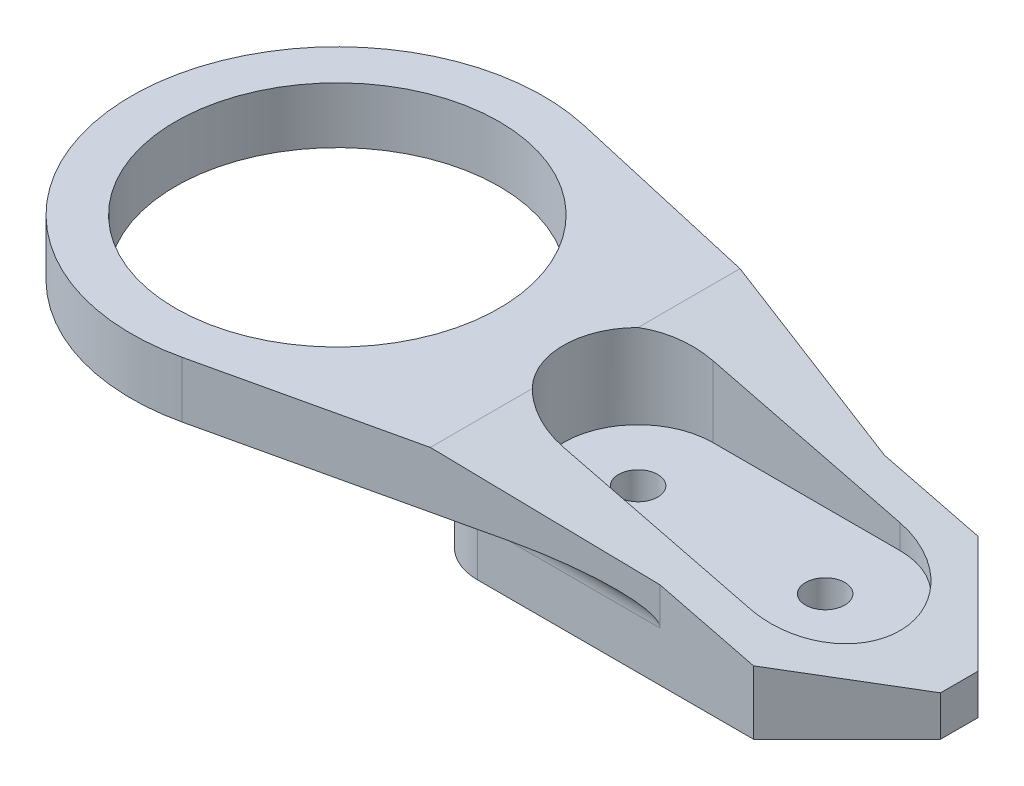
from build123d import *

# Parameters (mm, degrees)
SKETCH1_W           = 25
SKETCH1_H           = 7.15
BOSS_EXTRUDE1_DEPTH = 12
BOSS_EXTRUDE2_DEPTH = 3
CUT_EXTRUDE1_DEPTH  = 21
SKETCH4_R           = 8.65
CUT_EXTRUDE2_DEPTH  = 10
CHAMFER1_SIZE       = 5
CHAMFER1_SIZE2      = 20
CHAMFER2_SIZE       = 5
SKETCH6_R           = 1.05
CUT_EXTRUDE3_DEPTH  = 10
CUT_EXTRUDE4_DEPTH  = 4.5
FILLET1_R           = 3
FILLET2_R           = 1.5


with BuildPart() as part:
    # Sketch1 → Boss-Extrude1 (new body)
    with BuildSketch(Plane.XY):
        with Locations((12.5, 3.575)):
            Rectangle(SKETCH1_W, SKETCH1_H)
    extrude(amount=BOSS_EXTRUDE1_DEPTH)

    # Sketch2 → Boss-Extrude2 (add)
    with BuildSketch(Plane(origin=(0, 7.15, 0), x_dir=(1, 0, 0), z_dir=(0, 1, 0))):
        with BuildLine():
            Line((15, -12), (15, -6))
            Line((15, -6), (15, 0))
            Line((15, 0), (-5.804949202, 4.737516245))
            ThreePointArc((-5.804949202, 4.737516245), (-19.262380692, -6), (-5.804949202, -16.737516245))
            Line((-5.804949202, -16.737516245), (15, -12))
        make_face()
    extrude(amount=-BOSS_EXTRUDE2_DEPTH)

    # Sketch3 → Cut-Extrude1 (cut)
    with BuildSketch(Plane.XZ.offset(-4.15)):
        Polygon((2.25, 6), (2.25, 12), (0, 12), (0, 0), (2.25, 0), align=None)
    extrude(amount=CUT_EXTRUDE1_DEPTH, mode=Mode.SUBTRACT)

    # Sketch4 → Cut-Extrude2 (cut)
    with BuildSketch(Plane.XZ.offset(-4.15)):
        with Locations(Location((-8.25, 6, 0), (0, 0, 270))):
            Circle(SKETCH4_R)
    extrude(amount=-CUT_EXTRUDE2_DEPTH, mode=Mode.SUBTRACT)

    # Chamfer1
    chamfer1_edges = [part.edges().sort_by_distance(p)[0] for p in [
        (25, 7.15, 6),
    ]]
    chamfer1_side = [part.faces().sort_by_distance(p)[0] for p in [
        (25, 3.575, 6),
    ]]
    chamfer(chamfer1_edges, length=CHAMFER1_SIZE, length2=CHAMFER1_SIZE2, reference=chamfer1_side[0])

    # Chamfer2
    chamfer2_edges = [part.edges().sort_by_distance(p)[0] for p in [
        (25, 1.075, 0),
        (25, 1.075, 12),
    ]]
    chamfer(chamfer2_edges, length=CHAMFER2_SIZE)

    # Sketch6 → Cut-Extrude3 (cut)
    with BuildSketch(Plane(origin=(0, 7.15, 0), x_dir=(1, 0, 0), z_dir=(0, 1, 0))):
        with Locations(Location((7.829893366, -6, 0), (0, 0, 180))):
            Circle(SKETCH6_R)
        with Locations(Location((17.829893366, -6, 0), (0, 0, 180))):
            Circle(SKETCH6_R)
    extrude(amount=-CUT_EXTRUDE3_DEPTH, mode=Mode.SUBTRACT)

    # Sketch7 → Cut-Extrude4 (cut)
    with BuildSketch(Plane(origin=(0, 7.15, 0), x_dir=(1, 0, 0), z_dir=(0, 1, 0))):
        with BuildLine():
            Line((7.829893366, -2), (17.829893366, -2))
            ThreePointArc((17.829893366, -2), (21.829893366, -6), (17.829893366, -10))
            Line((17.829893366, -10), (7.829893366, -10))
            ThreePointArc((7.829893366, -10), (3.829893366, -6), (7.829893366, -2))
        make_face()
    extrude(amount=-CUT_EXTRUDE4_DEPTH, mode=Mode.SUBTRACT)

    # Fillet1
    fillet1_edges = [part.edges().sort_by_distance(p)[0] for p in [
        (2.25, 2.075, 0),
        (2.25, 2.075, 12),
    ]]
    fillet(fillet1_edges, radius=FILLET1_R)

    # Fillet2
    fillet2_edges = [part.edges().sort_by_distance(p)[0] for p in [
        (2.25, 4.15, 6),
        (10.125, 4.15, 12),
        (3.128679656, 4.15, 11.121320344),
        (3.128679656, 4.15, 0.878679656),
        (10.125, 4.15, 0),
    ]]
    fillet(fillet2_edges, radius=FILLET2_R)


solid = part.part
